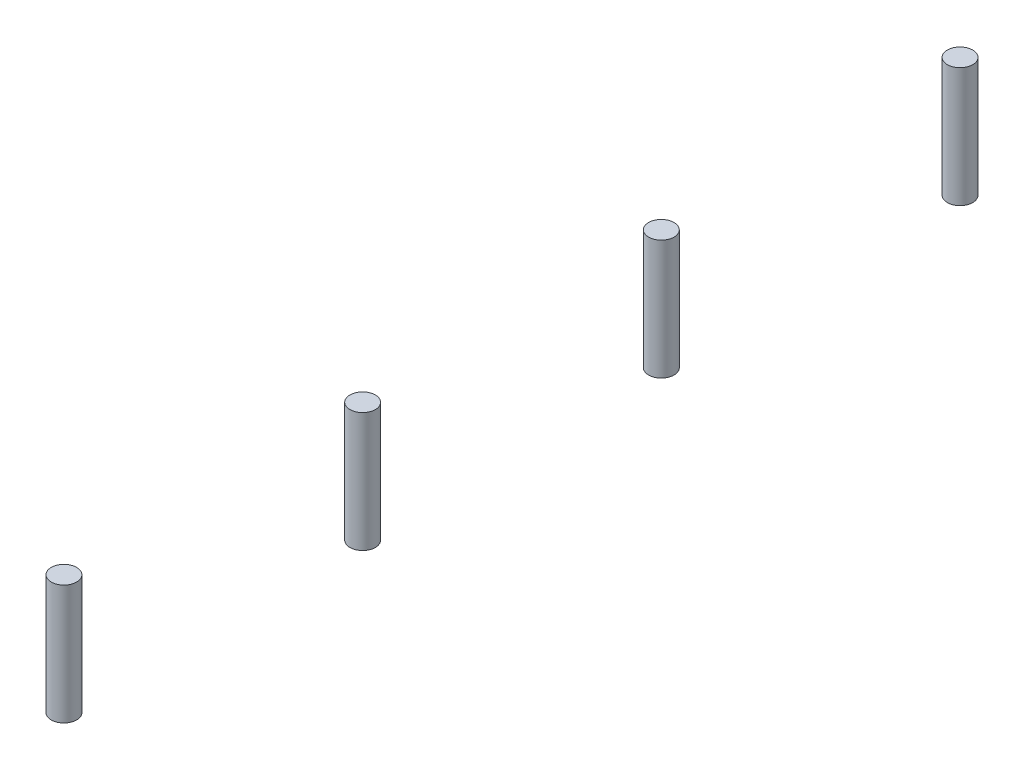
from build123d import *

# Parameters (mm, degrees)
SKETCH3_R             = 0.425
BOSS_EXTRUDE1_DEPTH   = 4
BOSS_EXTRUDE1_2_DEPTH = 4
BOSS_EXTRUDE1_3_DEPTH = 4
BOSS_EXTRUDE1_4_DEPTH = 4


with BuildPart() as part:
    # Sketch3 → Boss-Extrude1 (new body)
    with BuildSketch(Plane(origin=(0, 0, 0), x_dir=(1, 0, 0), z_dir=(0, 1, 0))):
        with Locations(Location((-1, 5, 0), (0, 0, 270))):
            Circle(SKETCH3_R)
    extrude(amount=BOSS_EXTRUDE1_DEPTH)


with BuildPart() as body_2:
    # Sketch3 → Boss-Extrude1 2 (new body)
    with BuildSketch(Plane(origin=(0, 0, 0), x_dir=(1, 0, 0), z_dir=(0, 1, 0))):
        with Locations(Location((-1, 15, 0), (0, 0, 270))):
            Circle(SKETCH3_R)
    extrude(amount=BOSS_EXTRUDE1_2_DEPTH)


with BuildPart() as body_3:
    # Sketch3 → Boss-Extrude1 3 (new body)
    with BuildSketch(Plane(origin=(0, 0, 0), x_dir=(1, 0, 0), z_dir=(0, 1, 0))):
        with Locations(Location((-1, 25, 0), (0, 0, 270))):
            Circle(SKETCH3_R)
    extrude(amount=BOSS_EXTRUDE1_3_DEPTH)


with BuildPart() as body_4:
    # Sketch3 → Boss-Extrude1 4 (new body)
    with BuildSketch(Plane(origin=(0, 0, 0), x_dir=(1, 0, 0), z_dir=(0, 1, 0))):
        with Locations(Location((-1, 35, 0), (0, 0, 270))):
            Circle(SKETCH3_R)
    extrude(amount=BOSS_EXTRUDE1_4_DEPTH)


solid = Compound([part.part, body_2.part, body_3.part, body_4.part])
